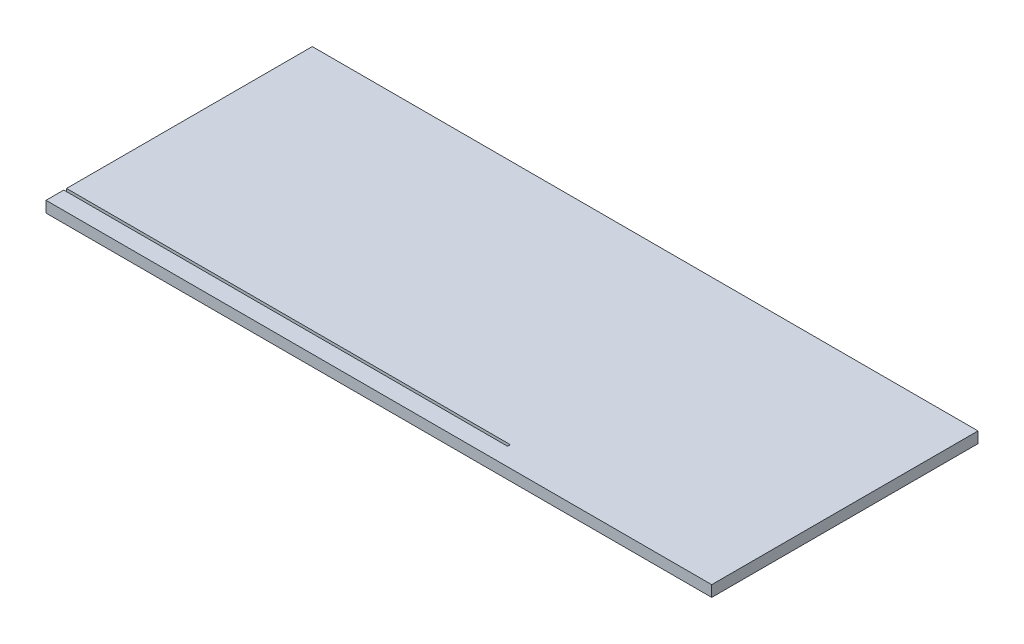
from build123d import *

# Parameters (mm, degrees)
SKETCH1_W           = 600
SKETCH1_H           = 240
BOSS_EXTRUDE1_DEPTH = 10
SKETCH2_W           = 400
SKETCH2_H           = 2.5
CUT_EXTRUDE1_DEPTH  = 2.5


with BuildPart() as part:
    # Sketch1 → Boss-Extrude1 (new body)
    with BuildSketch(Plane(origin=(0, 0, 0), x_dir=(1, 0, 0), z_dir=(0, 1, 0))):
        with Locations((300, 120)):
            Rectangle(SKETCH1_W, SKETCH1_H)
    extrude(amount=BOSS_EXTRUDE1_DEPTH)

    # Sketch2 → Cut-Extrude1 (cut)
    with BuildSketch(Plane(origin=(0, 10, 0), x_dir=(1, 0, 0), z_dir=(0, 1, 0))):
        with Locations((200, 17.25)):
            Rectangle(SKETCH2_W, SKETCH2_H)
    extrude(amount=-CUT_EXTRUDE1_DEPTH, mode=Mode.SUBTRACT)


solid = part.part
